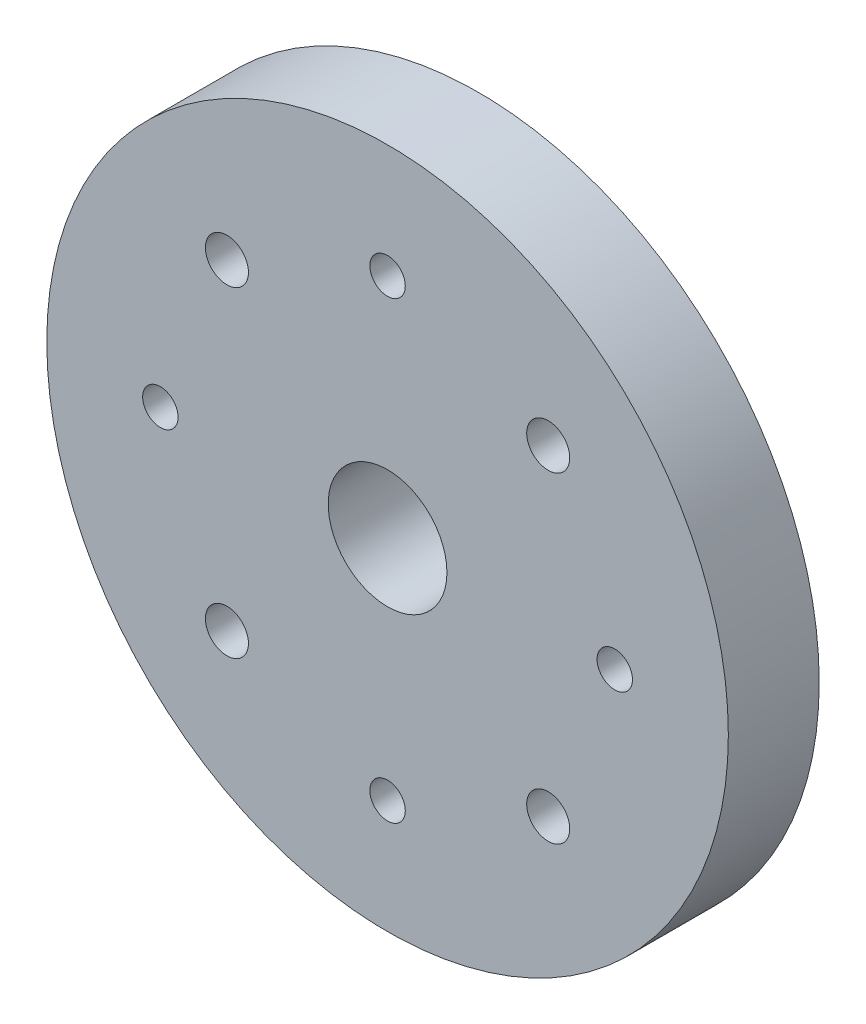
from build123d import *

# Parameters (mm, degrees)
SKETCH1_R           = 22.5
SKETCH1_R_2         = 4
SKETCH1_R_3         = 1.25
SKETCH1_R_4         = 1.5
BOSS_EXTRUDE1_DEPTH = 6
MOVE_FACE1_BY       = 0.08
MOVE_FACE1_2_BY     = 0.08
MOVE_FACE1_3_BY     = 0.08
MOVE_FACE1_4_BY     = 0.08
MOVE_FACE1_5_BY     = 0.08
MOVE_FACE1_6_BY     = 0.08
MOVE_FACE1_7_BY     = 0.08
MOVE_FACE1_8_BY     = 0.08
MOVE_FACE1_9_BY     = 0.08


with BuildPart() as part:
    # Sketch1 → Boss-Extrude1 (new body)
    with BuildSketch(Plane.XY):
        Circle(SKETCH1_R)
        Circle(SKETCH1_R_2, mode=Mode.SUBTRACT)
        with Locations((0, 15)):
            Circle(SKETCH1_R_3, mode=Mode.SUBTRACT)
        with Locations((10.606601718, 10.606601718)):
            Circle(SKETCH1_R_4, mode=Mode.SUBTRACT)
        with Locations((15, 0)):
            Circle(SKETCH1_R_3, mode=Mode.SUBTRACT)
        with Locations((10.606601718, -10.606601718)):
            Circle(SKETCH1_R_4, mode=Mode.SUBTRACT)
        with Locations((0, -15)):
            Circle(SKETCH1_R_3, mode=Mode.SUBTRACT)
        with Locations((-10.606601718, -10.606601718)):
            Circle(SKETCH1_R_4, mode=Mode.SUBTRACT)
        with Locations((-15, 0)):
            Circle(SKETCH1_R_3, mode=Mode.SUBTRACT)
        with Locations((-10.606601718, 10.606601718)):
            Circle(SKETCH1_R_4, mode=Mode.SUBTRACT)
    extrude(amount=BOSS_EXTRUDE1_DEPTH)

    # Move Face1: a curved face moved outward by 0.08
    add(Solid.thicken(part.faces().sort_by_distance((-4, 0, 3))[0], MOVE_FACE1_BY))

    # Move Face1 2: a curved face moved outward by 0.08
    add(Solid.thicken(part.faces().sort_by_distance((-1.25, 15, 3))[0], MOVE_FACE1_2_BY))

    # Move Face1 3: a curved face moved outward by 0.08
    add(Solid.thicken(part.faces().sort_by_distance((9.106601718, 10.606601718, 3))[0], MOVE_FACE1_3_BY))

    # Move Face1 4: a curved face moved outward by 0.08
    add(Solid.thicken(part.faces().sort_by_distance((13.75, 0, 3))[0], MOVE_FACE1_4_BY))

    # Move Face1 5: a curved face moved outward by 0.08
    add(Solid.thicken(part.faces().sort_by_distance((9.106601718, -10.606601718, 3))[0], MOVE_FACE1_5_BY))

    # Move Face1 6: a curved face moved outward by 0.08
    add(Solid.thicken(part.faces().sort_by_distance((-1.25, -15, 3))[0], MOVE_FACE1_6_BY))

    # Move Face1 7: a curved face moved outward by 0.08
    add(Solid.thicken(part.faces().sort_by_distance((-12.106601718, -10.606601718, 3))[0], MOVE_FACE1_7_BY))

    # Move Face1 8: a curved face moved outward by 0.08
    add(Solid.thicken(part.faces().sort_by_distance((-16.25, 0, 3))[0], MOVE_FACE1_8_BY))

    # Move Face1 9: a curved face moved outward by 0.08
    add(Solid.thicken(part.faces().sort_by_distance((-12.106601718, 10.606601718, 3))[0], MOVE_FACE1_9_BY))


solid = part.part
